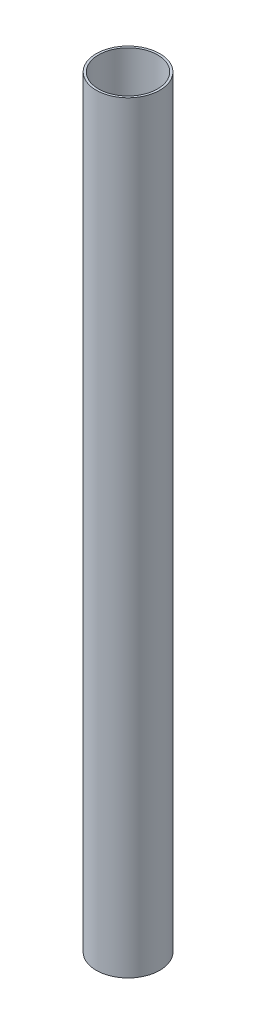
from build123d import *

# Parameters (mm, degrees)
SKETCH1_R           = 12.7
SKETCH1_R_2         = 11.811
BOSS_EXTRUDE1_DEPTH = 152.4


with BuildPart() as part:
    # Sketch1 → Boss-Extrude1 (new, symmetric)
    with BuildSketch(Plane(origin=(0, 0, 0), x_dir=(1, 0, 0), z_dir=(0, 1, 0))):
        with Locations(Location((0, 0, 0), (0, 0, 90))):
            Circle(SKETCH1_R)
        with Locations(Location((0, 0, 0), (0, 0, 90))):
            Circle(SKETCH1_R_2, mode=Mode.SUBTRACT)
    extrude(amount=BOSS_EXTRUDE1_DEPTH, both=True)


solid = part.part
